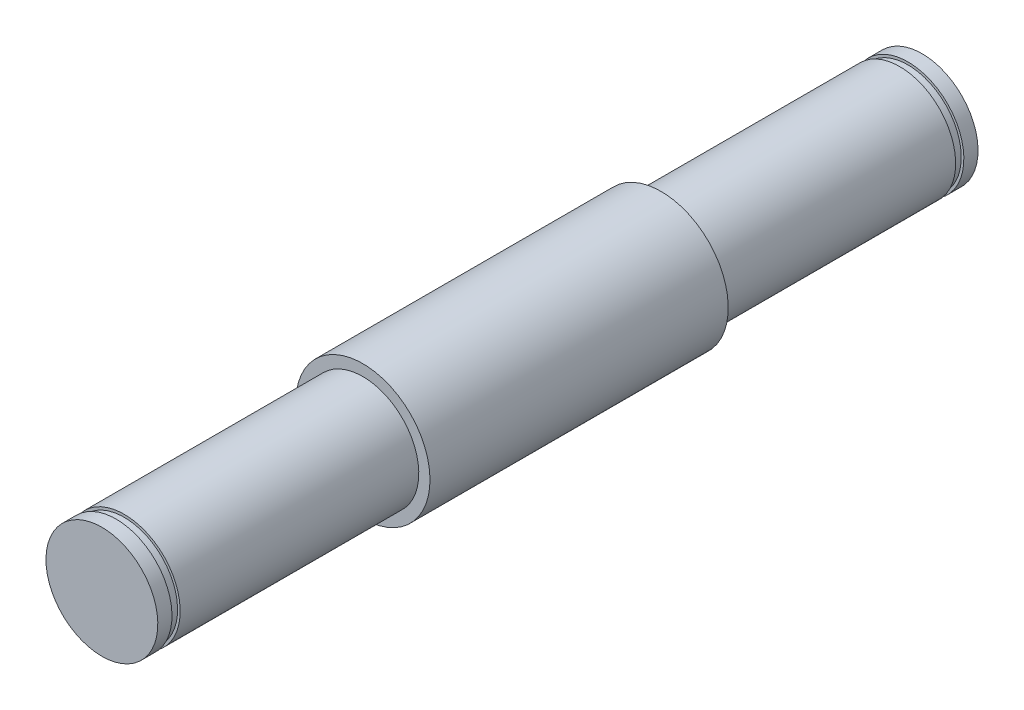
from build123d import *


with BuildPart() as part:
    # Szkic1 → Obrót1 (revolve)
    with BuildSketch(Plane(origin=(0, 0, 0), x_dir=(0, 0, -1), z_dir=(1, 0, 0))):
        Polygon((-55, 0), (55, 0), (55, -7.5), (53.1, -7.5), (53.1, -7.15), (52, -7.15), (52, -7.5), (20, -7.5), (20, -9), (-20, -9), (-20, -7.5), (-52, -7.5), (-52, -7.15), (-53.1, -7.15), (-53.1, -7.5), (-55, -7.5), align=None)
    revolve(axis=Axis((0, 0, 55), (0, 0, -1)))


solid = part.part
